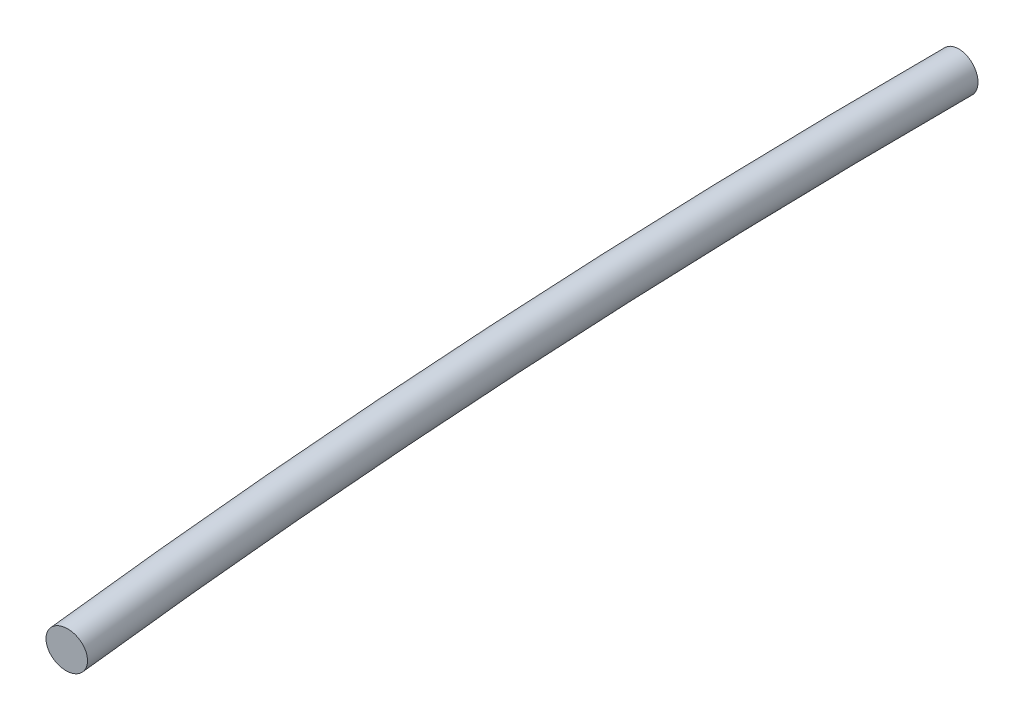
from build123d import *

# Parameters (mm, degrees)
SKETCH1_R = 50.8


with BuildPart() as part:
    # Sweep1: sweep along a path in Sketch2
    with BuildLine(Plane(origin=(-4687.695060265, -8379.886484648, 0), x_dir=(0.8455648946371895, -0.4730076459848942, 0.24755560142527056), z_dir=(0.4882036240797101, 0.8727297528074984, -2.8310687127941484e-15))) as sweep1_path:
        ThreePointArc((6175.558654101, 1577.908609455), (6503.031025405, 403.610943158), (6881.377344411, -755.296829674))
    # Sketch1 → Sweep1 (sweep)
    with BuildSketch(Plane.XY):
        with Locations((875.046338123, -11491.675102902)):
            Circle(SKETCH1_R)
    sweep(path=sweep1_path.line)


solid = part.part
